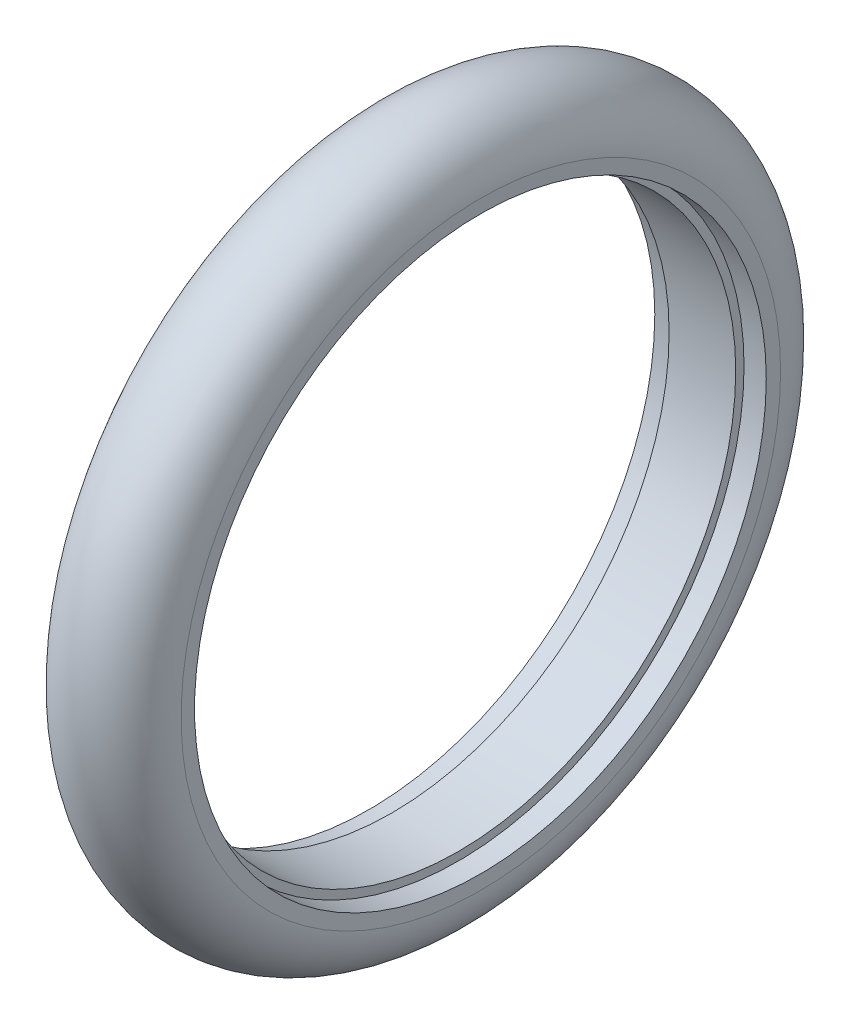
from build123d import *


with BuildPart() as part:
    # Sketch1 → Revolve1 (revolve)
    with BuildSketch(Plane.XY, mode=Mode.PRIVATE) as revolve1_sk:
        with BuildLine():
            Line((20.1625, 108), (20, 103))
            Line((20, 103), (12, 103))
            Line((12, 103), (12, 100))
            Line((12, 100), (-12, 100))
            Line((-12, 100), (-12, 103))
            Line((-12, 103), (-20.1625, 103))
            Line((-20.1625, 103), (-20.1625, 108))
            ThreePointArc((-20.1625, 108), (0, 128.1625), (20.1625, 108))
        make_face()
    revolve(revolve1_sk.sketch.rotate(Axis((88.99, 0, 0), (-1, 0, 0)), 90), axis=Axis((88.99, 0, 0), (-1, 0, 0)))


solid = part.part
